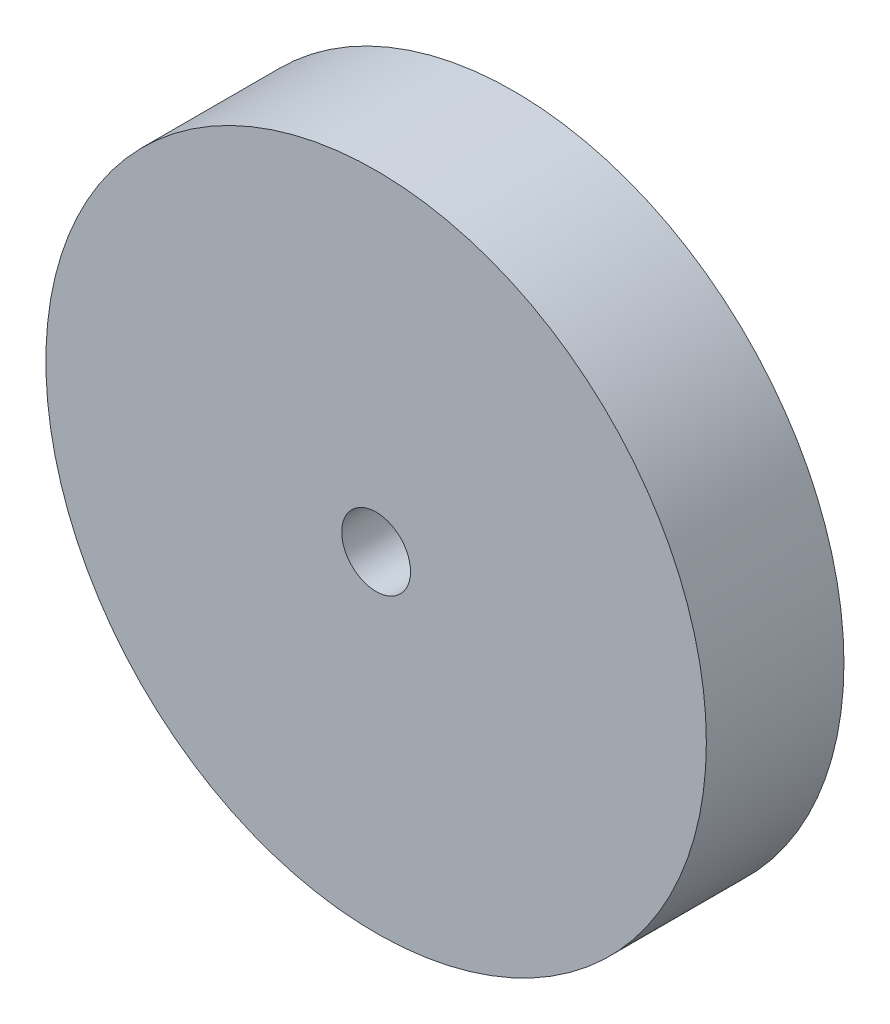
from build123d import *

# Parameters (mm, degrees)
SKETCH1_R           = 15.24
SKETCH1_R_2         = 1.5875
BOSS_EXTRUDE1_DEPTH = 6.35


with BuildPart() as part:
    # Sketch1 → Boss-Extrude1 (new body)
    with BuildSketch(Plane.XY):
        Circle(SKETCH1_R)
        Circle(SKETCH1_R_2, mode=Mode.SUBTRACT)
    extrude(amount=BOSS_EXTRUDE1_DEPTH)


solid = part.part
